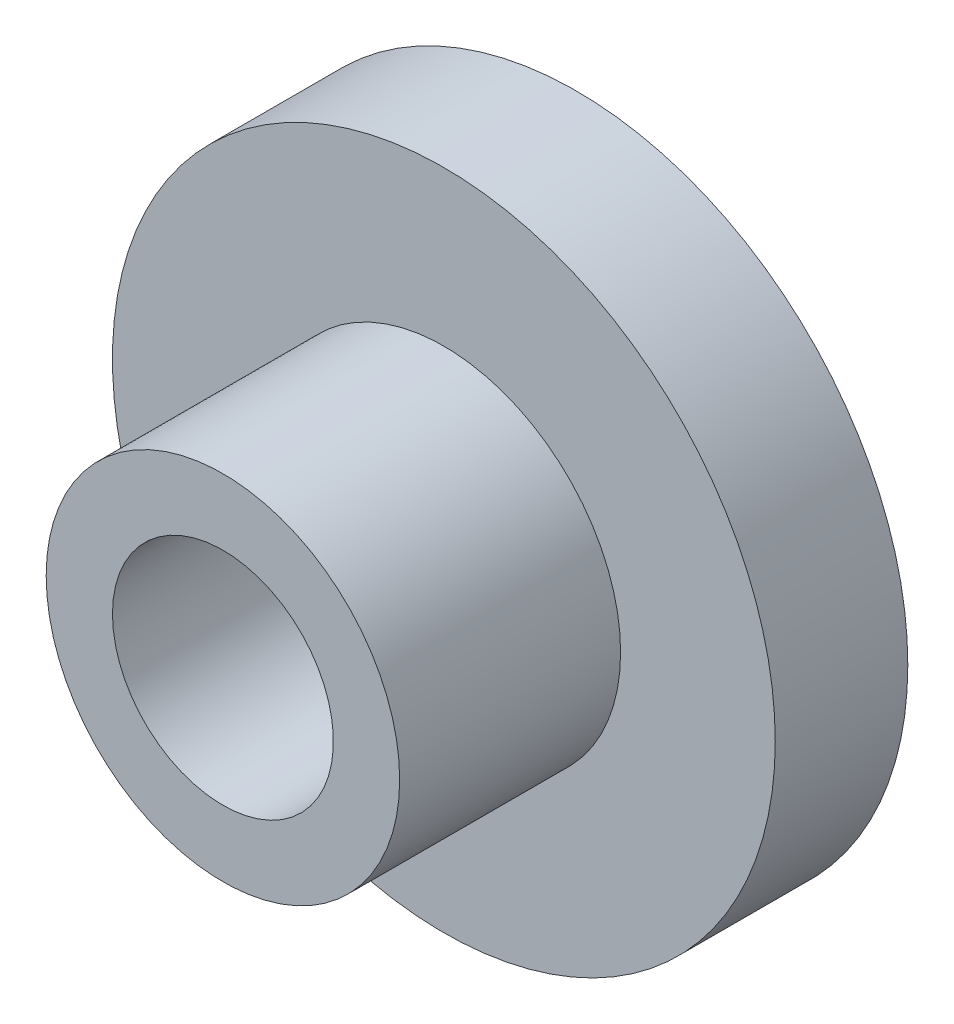
from build123d import *

# Parameters (mm, degrees)
SCHIZZO1_R                   = 7.5
ESTRUSIONE_ESTRUSIONE1_DEPTH = 3
SCHIZZO2_R                   = 4
ESTRUSIONE_ESTRUSIONE2_DEPTH = 5
SCHIZZO3_R                   = 2.5
TAGLIO_ESTRUSIONE1_DEPTH     = 14.285330256


with BuildPart() as part:
    # Schizzo1 → Estrusione-Estrusione1 (new body)
    with BuildSketch(Plane.XY):
        Circle(SCHIZZO1_R)
    extrude(amount=ESTRUSIONE_ESTRUSIONE1_DEPTH)

    # Schizzo2 → Estrusione-Estrusione2 (add)
    with BuildSketch(Plane.XY.offset(3)):
        Circle(SCHIZZO2_R)
    extrude(amount=ESTRUSIONE_ESTRUSIONE2_DEPTH)

    # Schizzo3 → Taglio-Estrusione1 (cut, through all)
    with BuildSketch(Plane(origin=(0, 0, 0), x_dir=(-1, 0, 0), z_dir=(0, 0, -1))):
        Circle(SCHIZZO3_R)
    extrude(amount=-TAGLIO_ESTRUSIONE1_DEPTH, mode=Mode.SUBTRACT)


solid = part.part
